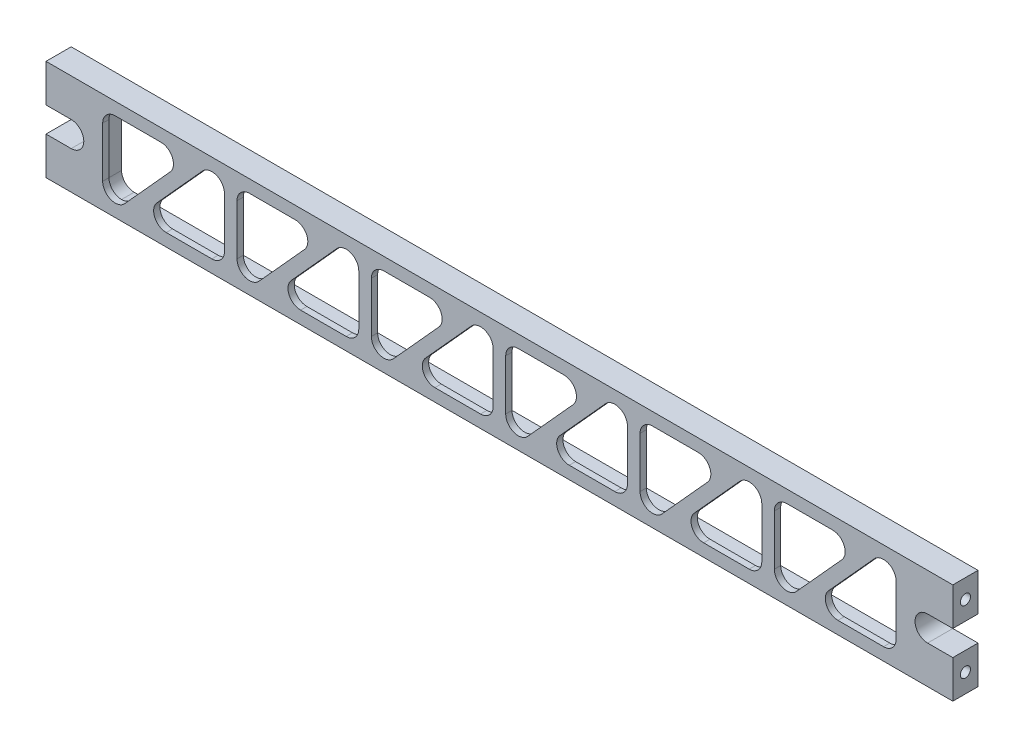
from build123d import *

# Parameters (mm, degrees)
SKETCH1_W                             = 12.7
SKETCH1_H                             = 50.8
BOSS_EXTRUDE1_DEPTH                   = 228.6
F_1_4_20_TAPPED_HOLE1_D               = 5.1054
F_1_4_20_TAPPED_HOLE1_DEPTH           = 19.05
F_1_4_20_TAPPED_HOLE1_TIP             = 1.533816902
F_1_4_20_TAPPED_HOLE1_ON_FACE_2_D     = 5.1054
F_1_4_20_TAPPED_HOLE1_ON_FACE_2_DEPTH = 19.05
F_1_4_20_TAPPED_HOLE1_ON_FACE_2_TIP   = 1.533816902
CUT_EXTRUDE1_DEPTH                    = 9.525
CUT_EXTRUDE2_DEPTH                    = 235.370061281
CUT_EXTRUDE3_DEPTH                    = 235.52055347


with BuildPart() as part:
    # Sketch1 → Boss-Extrude1 (new, symmetric)
    with BuildSketch(Plane(origin=(0, 0, 0), x_dir=(0, 0, -1), z_dir=(1, 0, 0))):
        with Locations((6.35, 25.4)):
            Rectangle(SKETCH1_W, SKETCH1_H)
    extrude(amount=BOSS_EXTRUDE1_DEPTH, both=True)

    # 1/4-20 Tapped Hole1
    with Locations(Plane(origin=(228.6, 41.275, -6.35), x_dir=(0, 0, 1), z_dir=(1, 0, 0))):
        with Locations((0, 0), (0, 31.75)):
            Hole(F_1_4_20_TAPPED_HOLE1_D / 2, depth=F_1_4_20_TAPPED_HOLE1_DEPTH)
            with Locations((0, 0, -(F_1_4_20_TAPPED_HOLE1_DEPTH + F_1_4_20_TAPPED_HOLE1_TIP / 2))):  # 118° drill point
                Cone(0, F_1_4_20_TAPPED_HOLE1_D / 2, F_1_4_20_TAPPED_HOLE1_TIP, mode=Mode.SUBTRACT)

    # 1/4-20 Tapped Hole1 on face 2
    with Locations(Plane(origin=(-228.6, 9.525, -6.35), x_dir=(0, 0, -1), z_dir=(-1, 0, 0))):
        with Locations((0, 0), (0, -31.75)):
            Hole(F_1_4_20_TAPPED_HOLE1_ON_FACE_2_D / 2, depth=F_1_4_20_TAPPED_HOLE1_ON_FACE_2_DEPTH)
            with Locations((0, 0, -(F_1_4_20_TAPPED_HOLE1_ON_FACE_2_DEPTH + F_1_4_20_TAPPED_HOLE1_ON_FACE_2_TIP / 2))):  # 118° drill point
                Cone(0, F_1_4_20_TAPPED_HOLE1_ON_FACE_2_D / 2, F_1_4_20_TAPPED_HOLE1_ON_FACE_2_TIP, mode=Mode.SUBTRACT)

    # Sketch4 → Cut-Extrude1 (cut)
    with BuildSketch(Plane(origin=(0, 0, -12.7), x_dir=(-1, 0, 0), z_dir=(0, 0, -1))):
        with BuildLine():
            Line((196.85, 47.625), (-196.85, 47.625))
            ThreePointArc((-196.85, 47.625), (-201.340128061, 45.765128061), (-203.2, 41.275))
            Line((-203.2, 41.275), (-203.2, 9.525))
            ThreePointArc((-203.2, 9.525), (-201.340128061, 5.034871939), (-196.85, 3.175))
            Line((-196.85, 3.175), (196.85, 3.175))
            ThreePointArc((196.85, 3.175), (201.340128061, 5.034871939), (203.2, 9.525))
            Line((203.2, 9.525), (203.2, 41.275))
            ThreePointArc((203.2, 41.275), (201.340128061, 45.765128061), (196.85, 47.625))
        make_face()
    extrude(amount=-CUT_EXTRUDE1_DEPTH, mode=Mode.SUBTRACT)

    # Sketch5 → Cut-Extrude2 (cut, through all)
    with BuildSketch(Plane(origin=(0, 0, -3.175), x_dir=(-1, 0, 0), z_dir=(0, 0, -1))):
        with BuildLine():
            Line((-200.025, 38.1), (-200.025, 12.7))
            ThreePointArc((-200.025, 12.7), (-198.165128061, 8.209871939), (-193.675, 6.35))
            Line((-193.675, 6.35), (-170.685762821, 6.35))
            ThreePointArc((-170.685762821, 6.35), (-164.88142117, 10.124710114), (-165.977774679, 16.961143938))
            Line((-165.977774679, 16.961143938), (-188.967011858, 42.361143938))
            ThreePointArc((-188.967011858, 42.361143938), (-195.9582844, 44.025294284), (-200.025, 38.1))
        make_face()
        with BuildLine():
            Line((-172.688891987, 33.838856062), (-149.699654808, 8.438856062))
            ThreePointArc((-149.699654808, 8.438856062), (-142.708382267, 6.774705716), (-138.641666667, 12.7))
            Line((-138.641666667, 12.7), (-138.641666667, 38.1))
            ThreePointArc((-138.641666667, 38.1), (-140.501538606, 42.590128061), (-144.991666667, 44.45))
            Line((-144.991666667, 44.45), (-167.980903846, 44.45))
            ThreePointArc((-167.980903846, 44.45), (-173.785245497, 40.675289886), (-172.688891987, 33.838856062))
        make_face()
        with BuildLine():
            Line((-132.291666667, 38.1), (-132.291666667, 12.7))
            ThreePointArc((-132.291666667, 12.7), (-130.431794727, 8.209871939), (-125.941666667, 6.35))
            Line((-125.941666667, 6.35), (-102.952429487, 6.35))
            ThreePointArc((-102.952429487, 6.35), (-97.148087836, 10.124710114), (-98.244441346, 16.961143938))
            Line((-98.244441346, 16.961143938), (-121.233678525, 42.361143938))
            ThreePointArc((-121.233678525, 42.361143938), (-128.224951067, 44.025294284), (-132.291666667, 38.1))
        make_face()
        with BuildLine():
            Line((-104.955558654, 33.838856062), (-81.966321475, 8.438856062))
            ThreePointArc((-81.966321475, 8.438856062), (-74.975048933, 6.774705716), (-70.908333333, 12.7))
            Line((-70.908333333, 12.7), (-70.908333333, 38.1))
            ThreePointArc((-70.908333333, 38.1), (-72.768205273, 42.590128061), (-77.258333333, 44.45))
            Line((-77.258333333, 44.45), (-100.247570513, 44.45))
            ThreePointArc((-100.247570513, 44.45), (-106.051912164, 40.675289886), (-104.955558654, 33.838856062))
        make_face()
        with BuildLine():
            Line((-64.558333333, 38.1), (-64.558333333, 12.7))
            ThreePointArc((-64.558333333, 12.7), (-62.698461394, 8.209871939), (-58.208333333, 6.35))
            Line((-58.208333333, 6.35), (-35.219096154, 6.35))
            ThreePointArc((-35.219096154, 6.35), (-29.414754503, 10.124710114), (-30.511108013, 16.961143938))
            Line((-30.511108013, 16.961143938), (-53.500345192, 42.361143938))
            ThreePointArc((-53.500345192, 42.361143938), (-60.491617733, 44.025294284), (-64.558333333, 38.1))
        make_face()
        with BuildLine():
            Line((-37.222225321, 33.838856062), (-14.232988142, 8.438856062))
            ThreePointArc((-14.232988142, 8.438856062), (-7.2417156, 6.774705716), (-3.175, 12.7))
            Line((-3.175, 12.7), (-3.175, 38.1))
            ThreePointArc((-3.175, 38.1), (-5.034871939, 42.590128061), (-9.525, 44.45))
            Line((-9.525, 44.45), (-32.514237179, 44.45))
            ThreePointArc((-32.514237179, 44.45), (-38.31857883, 40.675289886), (-37.222225321, 33.838856062))
        make_face()
        with BuildLine():
            Line((3.175, 38.1), (3.175, 12.7))
            ThreePointArc((3.175, 12.7), (5.034871939, 8.209871939), (9.525, 6.35))
            Line((9.525, 6.35), (32.514237179, 6.35))
            ThreePointArc((32.514237179, 6.35), (38.31857883, 10.124710114), (37.222225321, 16.961143938))
            Line((37.222225321, 16.961143938), (14.232988142, 42.361143938))
            ThreePointArc((14.232988142, 42.361143938), (7.2417156, 44.025294284), (3.175, 38.1))
        make_face()
        with BuildLine():
            Line((30.511108013, 33.838856062), (53.500345192, 8.438856062))
            ThreePointArc((53.500345192, 8.438856062), (60.491617733, 6.774705716), (64.558333333, 12.7))
            Line((64.558333333, 12.7), (64.558333333, 38.1))
            ThreePointArc((64.558333333, 38.1), (62.698461394, 42.590128061), (58.208333333, 44.45))
            Line((58.208333333, 44.45), (35.219096154, 44.45))
            ThreePointArc((35.219096154, 44.45), (29.414754503, 40.675289886), (30.511108013, 33.838856062))
        make_face()
        with BuildLine():
            Line((70.908333333, 38.1), (70.908333333, 12.7))
            ThreePointArc((70.908333333, 12.7), (72.768205273, 8.209871939), (77.258333333, 6.35))
            Line((77.258333333, 6.35), (100.247570513, 6.35))
            ThreePointArc((100.247570513, 6.35), (106.051912164, 10.124710114), (104.955558654, 16.961143938))
            Line((104.955558654, 16.961143938), (81.966321475, 42.361143938))
            ThreePointArc((81.966321475, 42.361143938), (74.975048933, 44.025294284), (70.908333333, 38.1))
        make_face()
        with BuildLine():
            Line((98.244441346, 33.838856062), (121.233678525, 8.438856062))
            ThreePointArc((121.233678525, 8.438856062), (128.224951067, 6.774705716), (132.291666667, 12.7))
            Line((132.291666667, 12.7), (132.291666667, 38.1))
            ThreePointArc((132.291666667, 38.1), (130.431794727, 42.590128061), (125.941666667, 44.45))
            Line((125.941666667, 44.45), (102.952429487, 44.45))
            ThreePointArc((102.952429487, 44.45), (97.148087836, 40.675289886), (98.244441346, 33.838856062))
        make_face()
        with BuildLine():
            Line((138.641666667, 38.1), (138.641666667, 12.7))
            ThreePointArc((138.641666667, 12.7), (140.501538606, 8.209871939), (144.991666667, 6.35))
            Line((144.991666667, 6.35), (167.980903846, 6.35))
            ThreePointArc((167.980903846, 6.35), (173.785245497, 10.124710114), (172.688891987, 16.961143938))
            Line((172.688891987, 16.961143938), (149.699654808, 42.361143938))
            ThreePointArc((149.699654808, 42.361143938), (142.708382267, 44.025294284), (138.641666667, 38.1))
        make_face()
        with BuildLine():
            Line((165.977774679, 33.838856062), (188.967011858, 8.438856062))
            ThreePointArc((188.967011858, 8.438856062), (195.9582844, 6.774705716), (200.025, 12.7))
            Line((200.025, 12.7), (200.025, 38.1))
            ThreePointArc((200.025, 38.1), (198.165128061, 42.590128061), (193.675, 44.45))
            Line((193.675, 44.45), (170.685762821, 44.45))
            ThreePointArc((170.685762821, 44.45), (164.88142117, 40.675289886), (165.977774679, 33.838856062))
        make_face()
    extrude(amount=-CUT_EXTRUDE2_DEPTH, mode=Mode.SUBTRACT)

    # Sketch6 → Cut-Extrude3 (cut, through all)
    with BuildSketch(Plane.XY):
        with BuildLine():
            Line((-215.9, 31.75), (-228.6, 31.75))
            Line((-228.6, 31.75), (-228.6, 19.05))
            Line((-228.6, 19.05), (-215.9, 19.05))
            ThreePointArc((-215.9, 19.05), (-209.55, 25.4), (-215.9, 31.75))
        make_face()
        with BuildLine():
            Line((228.6, 19.05), (215.9, 19.05))
            ThreePointArc((215.9, 19.05), (209.55, 25.4), (215.9, 31.75))
            Line((215.9, 31.75), (228.6, 31.75))
            Line((228.6, 31.75), (228.6, 19.05))
        make_face()
    extrude(amount=-CUT_EXTRUDE3_DEPTH, mode=Mode.SUBTRACT)


solid = part.part
